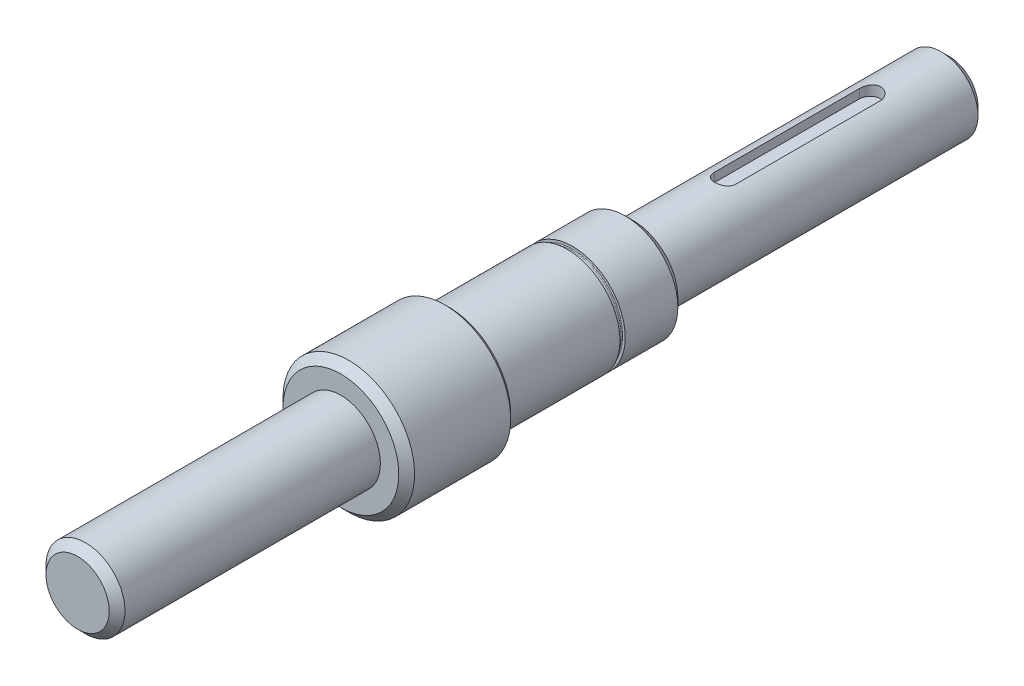
from build123d import *

# Parameters (mm, degrees)
CHAMFER_1_SIZE         = 3
HOLE_WIZARD_M121_D     = 10.2
HOLE_WIZARD_M121_DEPTH = 30
HOLE_WIZARD_M121_TIP   = 3.064389157
SKETCH_4_R             = 20
SKETCH_4_R_2           = 18.75
CUT_EXTRUDE_1_DEPTH    = 2
FILLET_1_R             = 0.3
CHAMFER_2_SIZE         = 1.5
CUT_EXTRUDE_2_DEPTH    = 334.782863551
SKETCH_9_R             = 25
SKETCH_9_R_2           = 20
CUT_EXTRUDE_4_DEPTH    = 6
CHAMFER_3_SIZE         = 1.5
CHAMFER_4_SIZE         = 3


with BuildPart() as part:
    # Эскиз1 → Повернуть1 (revolve)
    with BuildSketch(Plane(origin=(0, 0, 0), x_dir=(0, 0, -1), z_dir=(1, 0, 0)), mode=Mode.PRIVATE) as revolve_1_sk:
        Polygon((0, 0), (0, 15), (100, 15), (100, 25), (147, 25), (147, 20), (211, 20), (211, 14), (331, 14), (331, 0), align=None)
    revolve(revolve_1_sk.sketch.rotate(Axis((0, 0, 0), (0, 0, -1)), 90), axis=Axis((0, 0, 0), (0, 0, -1)))

    # Фаска1
    chamfer_1_edges = [part.edges().sort_by_distance(p)[0] for p in [
        (-25, 0, -100),
        (-15, 0, 0),
        (-14, 0, -331),
    ]]
    chamfer(chamfer_1_edges, length=CHAMFER_1_SIZE)

    # Отверстие обработанное метчиком M121
    with Locations(Plane(origin=(0, 0, -331), x_dir=(-1, 0, 0), z_dir=(0, 0, -1))):
        with Locations((0, 0)):
            Hole(HOLE_WIZARD_M121_D / 2, depth=HOLE_WIZARD_M121_DEPTH)
            with Locations((0, 0, -(HOLE_WIZARD_M121_DEPTH + HOLE_WIZARD_M121_TIP / 2))):  # 118° drill point
                Cone(0, HOLE_WIZARD_M121_D / 2, HOLE_WIZARD_M121_TIP, mode=Mode.SUBTRACT)

    # Эскиз4 → Вырез-Вытянуть1 (cut)
    with BuildSketch(Plane(origin=(0, 0, -188), x_dir=(-1, 0, 0), z_dir=(0, 0, -1))):
        with Locations(Location((0, 0, 0), (0, 0, 180))):
            Circle(SKETCH_4_R)
        Circle(SKETCH_4_R_2, mode=Mode.SUBTRACT)
    extrude(amount=-CUT_EXTRUDE_1_DEPTH, mode=Mode.SUBTRACT)

    # Скругление1
    fillet_1_edges = [part.edges().sort_by_distance(p)[0] for p in [
        (18.75, 0, -186),
        (18.75, 0, -188),
    ]]
    fillet(fillet_1_edges, radius=FILLET_1_R)

    # Фаска2
    chamfer_2_edges = [part.edges().sort_by_distance(p)[0] for p in [
        (-25, 0, -147),
    ]]
    chamfer(chamfer_2_edges, length=CHAMFER_2_SIZE)

    # Эскиз8 → Вырез-Вытянуть2 (cut, through all)
    with BuildSketch(Plane(origin=(0, 10, -331), x_dir=(-1, 0, 0), z_dir=(0, -1, 0))):
        with BuildLine():
            Line((4, -30), (4, -85))
            ThreePointArc((4, -85), (0, -89), (-4, -85))
            Line((-4, -85), (-4, -30))
            ThreePointArc((-4, -30), (0, -26), (4, -30))
        make_face()
    extrude(amount=-CUT_EXTRUDE_2_DEPTH, mode=Mode.SUBTRACT)

    # Эскиз9 → Вырез-Вытянуть4 (cut)
    with BuildSketch(Plane(origin=(0, 0, -147), x_dir=(-1, 0, 0), z_dir=(0, 0, -1))):
        Circle(SKETCH_9_R)
        Circle(SKETCH_9_R_2, mode=Mode.SUBTRACT)
    extrude(amount=-CUT_EXTRUDE_4_DEPTH, mode=Mode.SUBTRACT)

    # Фаска3
    chamfer_3_edges = [part.edges().sort_by_distance(p)[0] for p in [
        (-25, 0, -141),
    ]]
    chamfer(chamfer_3_edges, length=CHAMFER_3_SIZE)

    # Фаска4
    chamfer_4_edges = [part.edges().sort_by_distance(p)[0] for p in [
        (-20, 0, -211),
    ]]
    chamfer(chamfer_4_edges, length=CHAMFER_4_SIZE)


solid = part.part
